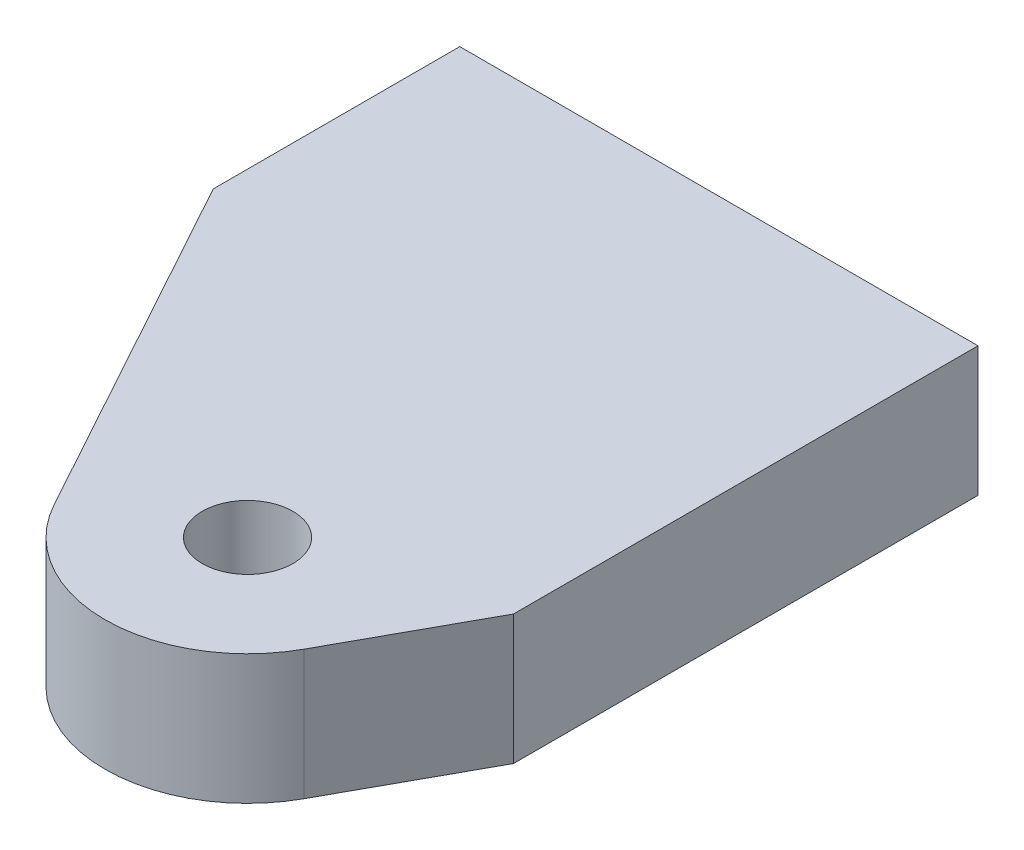
from build123d import *

# Parameters (mm, degrees)
SKETCH1_R           = 1.75
BOSS_EXTRUDE1_DEPTH = 5


with BuildPart() as part:
    # Sketch1 → Boss-Extrude1 (new body)
    with BuildSketch(Plane(origin=(0, 0, 0), x_dir=(1, 0, 0), z_dir=(0, 1, 0))):
        with BuildLine():
            Line((-10, 0), (10, 0))
            Line((10, 0), (10, -17.924245678))
            Line((10, -17.924245678), (7.130611347, -23.147962658))
            ThreePointArc((7.130611347, -23.147962658), (2.31, -26), (-2.510611347, -23.147962658))
            Line((-2.510611347, -23.147962658), (-10, -9.513543829))
            Line((-10, -9.513543829), (-10, 0))
        make_face()
        with Locations(Location((2.31, -20.5, 0), (0, 0, 270))):
            Circle(SKETCH1_R, mode=Mode.SUBTRACT)
    extrude(amount=BOSS_EXTRUDE1_DEPTH)


solid = part.part
